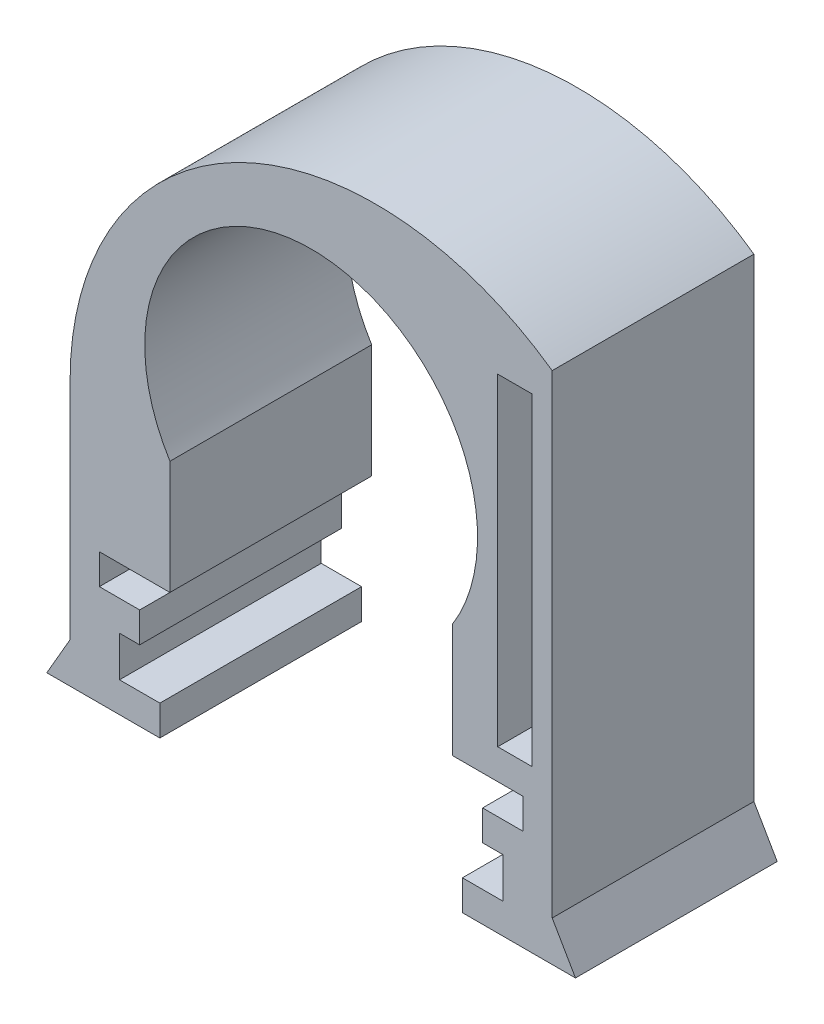
from build123d import *

# Parameters (mm, degrees)
SKETCH1_W           = 1.7
SKETCH1_H           = 16
BOSS_EXTRUDE1_DEPTH = 10


with BuildPart() as part:
    # Sketch1 → Boss-Extrude1 (new body)
    with BuildSketch(Plane.XY):
        with BuildLine():
            Line((8.5, -13), (9.5, -13))
            Line((9.5, -13), (9.5, -15))
            Line((9.5, -15), (7.5, -15))
            Line((7.5, -15), (7.5, -16.5))
            Line((7.5, -16.5), (13.104700538, -16.5))
            Line((13.104700538, -16.5), (11.95, -14.5))
            Line((11.95, -14.5), (11.95, 9))
            ThreePointArc((11.95, 9), (-3.764514939, 10.079270346), (-11.95, -3.378390615))
            Line((-11.95, -3.378390615), (-11.95, -14.5))
            Line((-11.95, -14.5), (-13.104700538, -16.5))
            Line((-13.104700538, -16.5), (-7.5, -16.5))
            Line((-7.5, -16.5), (-7.5, -15))
            Line((-7.5, -15), (-9.5, -15))
            Line((-9.5, -15), (-9.5, -13))
            Line((-9.5, -13), (-8.5, -13))
            Line((-8.5, -13), (-8.5, -11.5))
            Line((-8.5, -11.5), (-10.5, -11.5))
            Line((-10.5, -11.5), (-10.5, -10))
            Line((-10.5, -10), (-7, -10))
            Line((-7, -10), (-7, -4.366062299))
            ThreePointArc((-7, -4.366062299), (0, 8.25), (7, -4.366062299))
            Line((7, -4.366062299), (7, -10))
            Line((7, -10), (10.5, -10))
            Line((10.5, -10), (10.5, -11.5))
            Line((10.5, -11.5), (8.5, -11.5))
            Line((8.5, -11.5), (8.5, -13))
        make_face()
        with Locations((10.1, -0.5)):
            Rectangle(SKETCH1_W, SKETCH1_H, mode=Mode.SUBTRACT)
    extrude(amount=BOSS_EXTRUDE1_DEPTH)


solid = part.part
